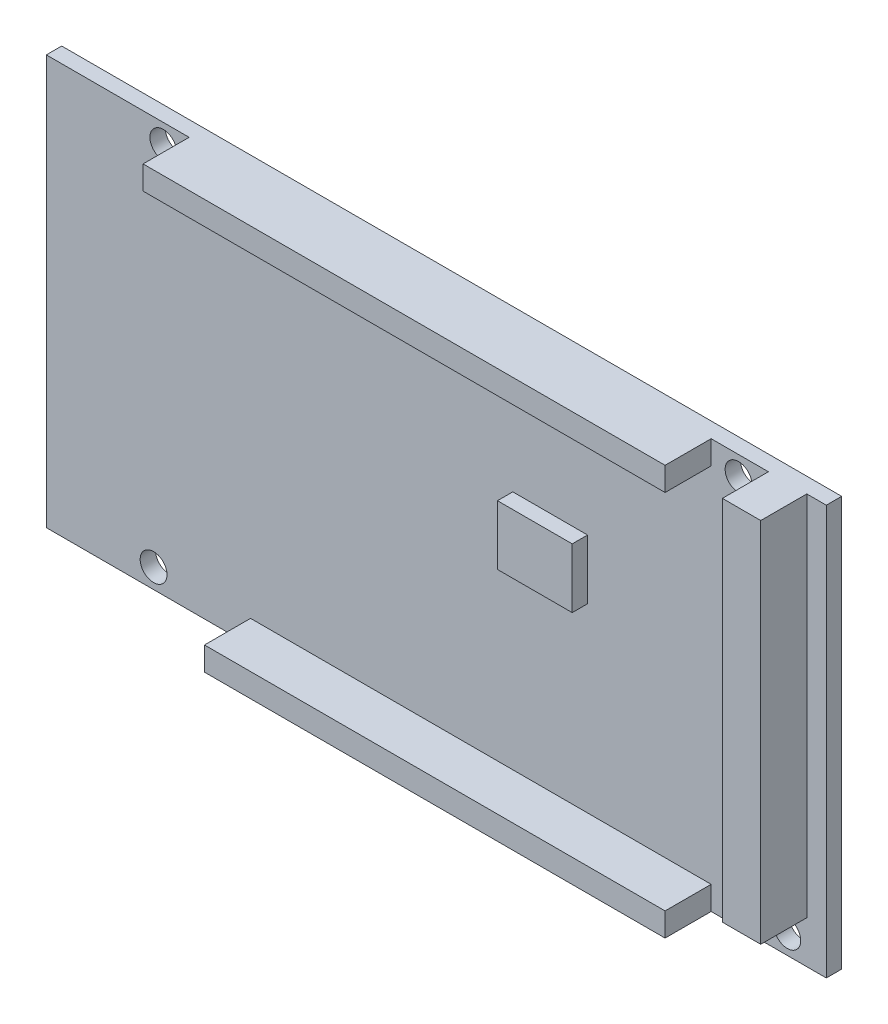
from build123d import *

# Parameters (mm, degrees)
SKETCH_1_W      = 101.6
SKETCH_1_H      = 53.34
SKETCH_1_R      = 1.75
EXTRUDE_1_DEPTH = 2
SKETCH_2_W      = 68
SKETCH_2_H      = 3.07
SKETCH_2_W_2    = 60
SKETCH_2_W_3    = 5
SKETCH_2_H_2    = 47.81
EXTRUDE_2_DEPTH = 6
SKETCH_3_W      = 9.737104959
SKETCH_3_H      = 7.755742322
EXTRUDE_3_DEPTH = 2


with BuildPart() as part:
    # 草图1 → 凸台-拉伸1 (new body)
    with BuildSketch(Plane.XY):
        Rectangle(SKETCH_1_W, SKETCH_1_H)
        with Locations((-35.56, 24.13)):
            Circle(SKETCH_1_R, mode=Mode.SUBTRACT)
        with Locations((-36.83, -24.13)):
            Circle(SKETCH_1_R, mode=Mode.SUBTRACT)
        with Locations((45.72, -24.13)):
            Circle(SKETCH_1_R, mode=Mode.SUBTRACT)
        with Locations((39.37, 24.13)):
            Circle(SKETCH_1_R, mode=Mode.SUBTRACT)
    extrude(amount=EXTRUDE_1_DEPTH)

    # 草图2 → 凸台-拉伸2 (add)
    with BuildSketch(Plane.XY.offset(2)):
        with Locations((1.8, 25.135)):
            Rectangle(SKETCH_2_W, SKETCH_2_H)
        with Locations((5.8, -25.135)):
            Rectangle(SKETCH_2_W_2, SKETCH_2_H)
        with Locations((45.76, 2.765)):
            Rectangle(SKETCH_2_W_3, SKETCH_2_H_2)
    extrude(amount=EXTRUDE_2_DEPTH)

    # 草图3 → 凸台-拉伸3 (add)
    with BuildSketch(Plane.XY.offset(2)):
        with Locations((14.832089241, 3.877871161)):
            Rectangle(SKETCH_3_W, SKETCH_3_H)
    extrude(amount=EXTRUDE_3_DEPTH)


solid = part.part
